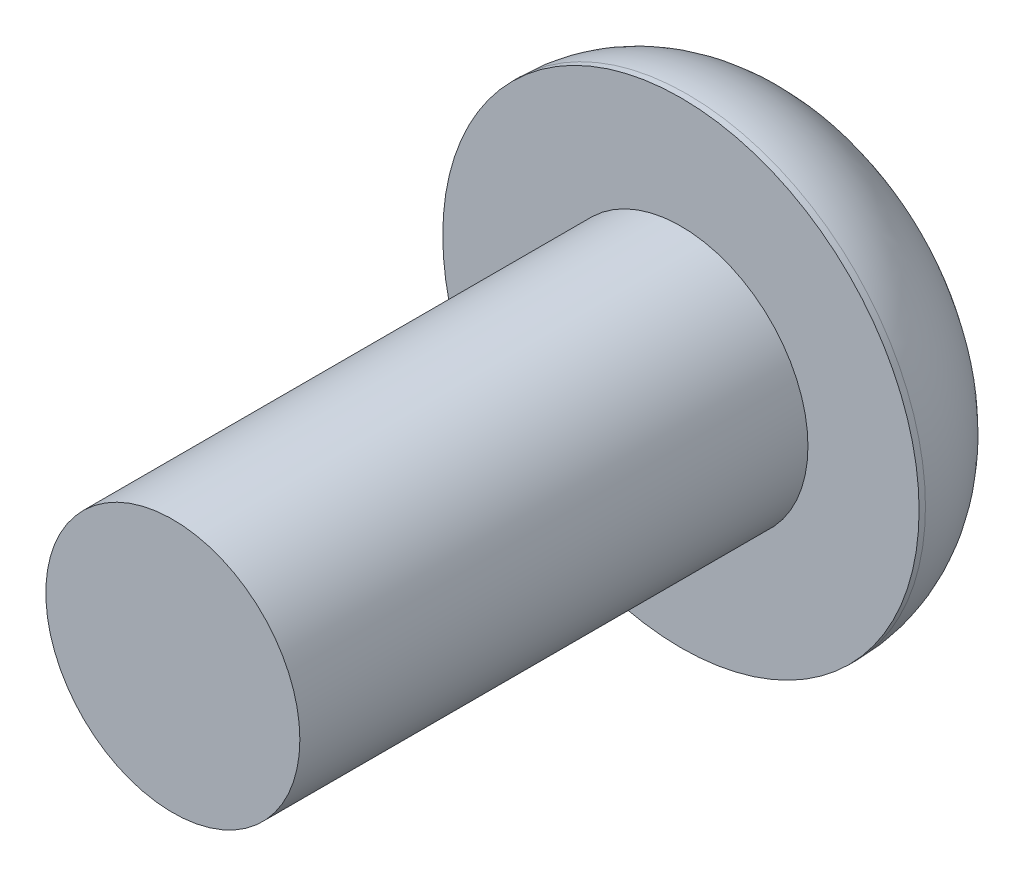
from build123d import *

# Parameters (mm, degrees)
SKETCH_1_R      = 2
EXTRUDE_1_DEPTH = 8
SKETCH_2_R      = 3.75
EXTRUDE_2_DEPTH = 2.1
FILLET_1_R      = 2


with BuildPart() as part:
    # 草图1 → 凸台-拉伸1 (new body)
    with BuildSketch(Plane.XY):
        Circle(SKETCH_1_R)
    extrude(amount=EXTRUDE_1_DEPTH)

    # 草图2 → 凸台-拉伸2 (add)
    with BuildSketch(Plane(origin=(0, 0, 0), x_dir=(-1, 0, 0), z_dir=(0, 0, -1))):
        Circle(SKETCH_2_R)
    extrude(amount=EXTRUDE_2_DEPTH)

    # 圆角1
    fillet_1_edges = [part.edges().sort_by_distance(p)[0] for p in [
        (3.75, 0, -2.1),
    ]]
    fillet(fillet_1_edges, radius=FILLET_1_R)


solid = part.part
